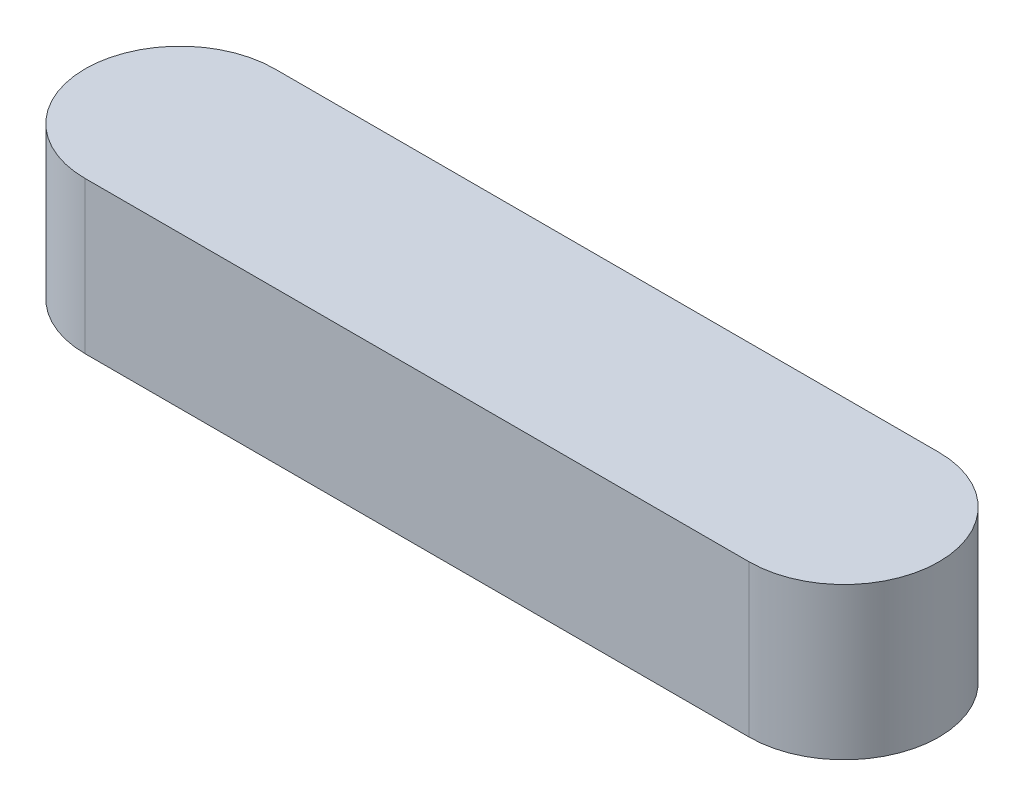
from build123d import *

# Parameters (mm, degrees)
BOSS_EXTRUDE1_DEPTH      = 2
BOSS_EXTRUDE1_DEPTH_BACK = 2


with BuildPart() as part:
    # Sketch1 → Boss-Extrude1 (new, two sides: drawn at the far end of the back side and taken through both)
    with BuildSketch(Plane(origin=(0, 0, 0), x_dir=(1, 0, 0), z_dir=(0, 1, 0)).offset(-BOSS_EXTRUDE1_DEPTH_BACK)):
        with BuildLine():
            Line((8.75, 2.5), (-8.75, 2.5))
            ThreePointArc((-8.75, 2.5), (-11.25, 0), (-8.75, -2.5))
            Line((-8.75, -2.5), (8.75, -2.5))
            ThreePointArc((8.75, -2.5), (11.25, 0), (8.75, 2.5))
        make_face()
    extrude(amount=BOSS_EXTRUDE1_DEPTH + BOSS_EXTRUDE1_DEPTH_BACK)


solid = part.part
